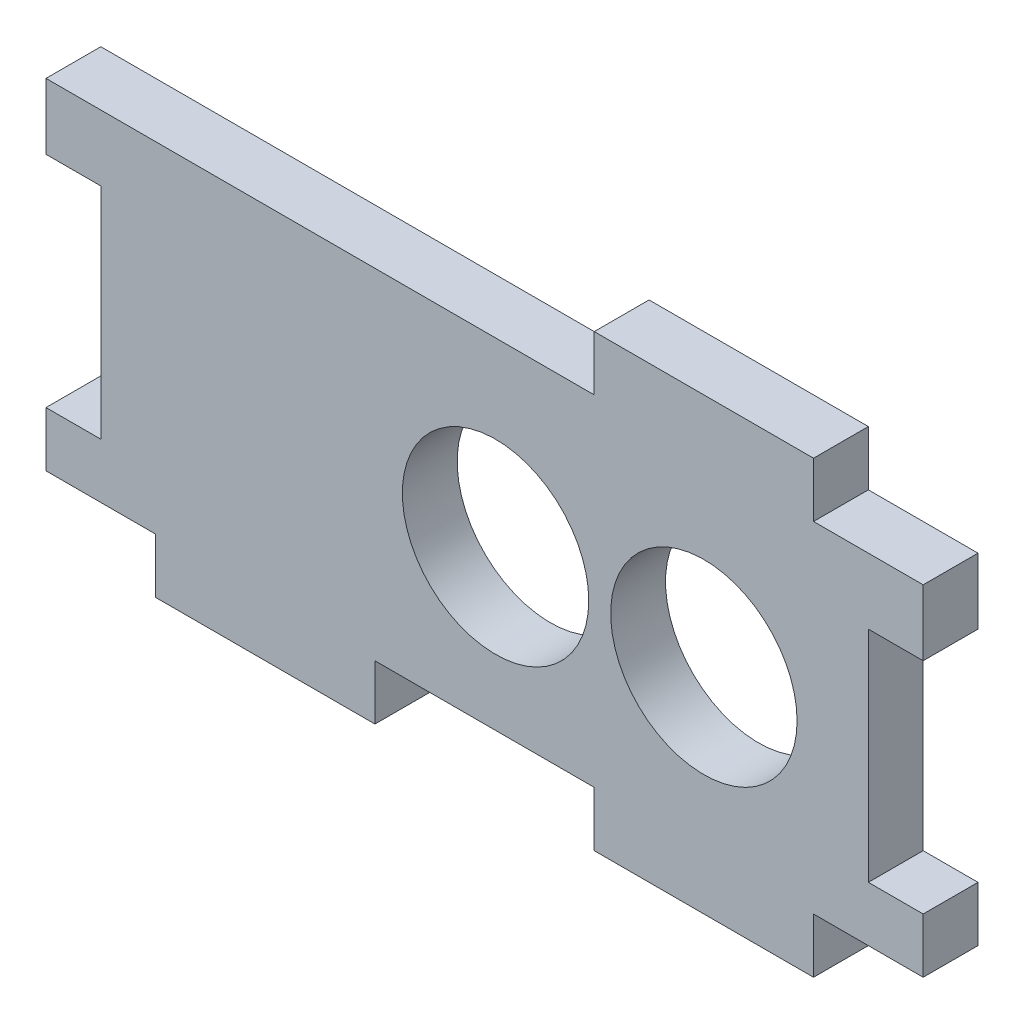
from build123d import *

# Parameters (mm, degrees)
SKETCH2_R           = 8.5
BOSS_EXTRUDE1_DEPTH = 5


with BuildPart() as part:
    # Sketch2 → Boss-Extrude1 (new body)
    with BuildSketch(Plane.XY):
        Polygon((0, 31), (0, 25), (5, 25), (5, 5), (0, 5), (0, 0), (10, 0), (10, -5), (30, -5), (30, 0), (50, 0), (50, -5), (70, -5), (70, 0), (80, 0), (80, 5), (75, 5), (75, 25), (80, 25), (80, 31), (70, 31), (70, 36), (50, 36), (50, 31), align=None)
        with Locations((41, 14.5)):
            Circle(SKETCH2_R, mode=Mode.SUBTRACT)
        with Locations((60, 14.5)):
            Circle(SKETCH2_R, mode=Mode.SUBTRACT)
    extrude(amount=-BOSS_EXTRUDE1_DEPTH)


solid = part.part
